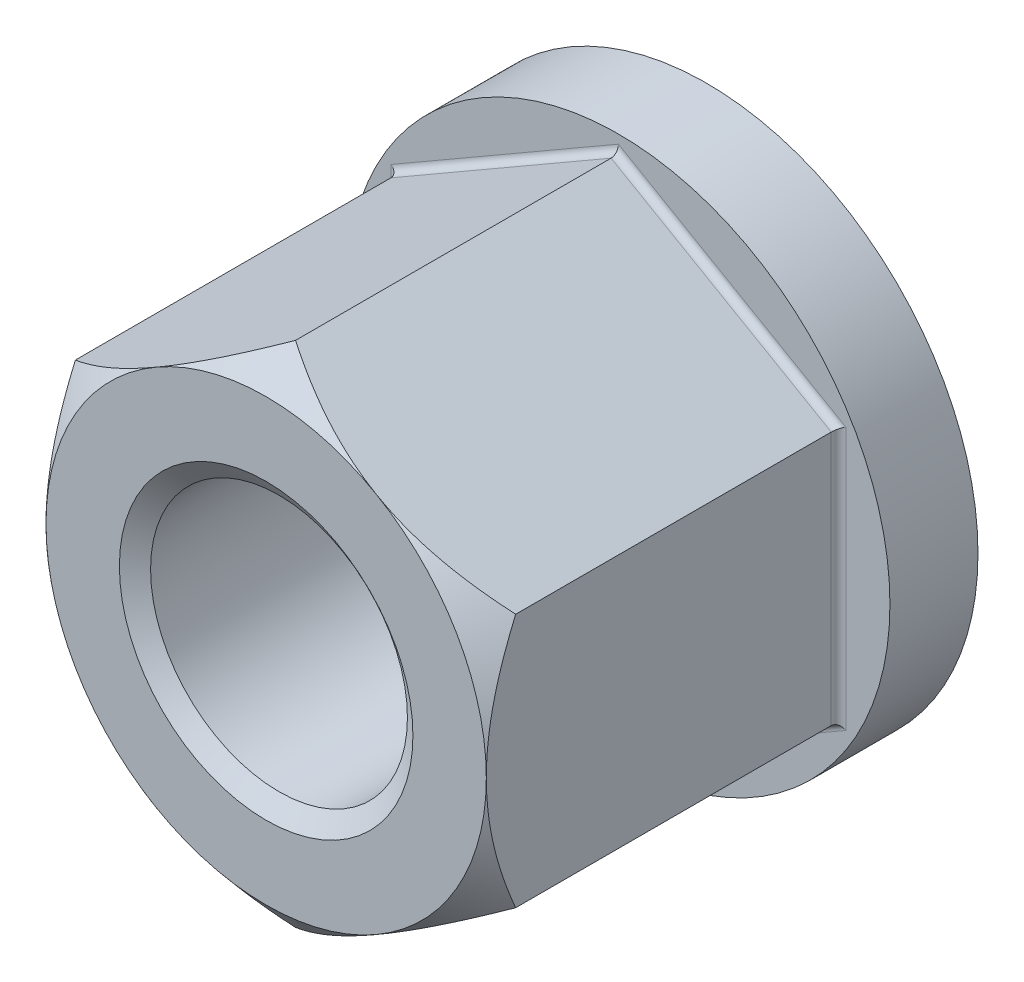
from build123d import *

# Parameters (mm, degrees)
BASENUTSKE_R  = 8.75
BASENUT_DEPTH = 30
COLLARSKE_W   = 6
COLLARSKE_H   = 9.75
FILLET_2_R    = 0.5


with BuildPart() as part:
    # BaseNutSke → BaseNut (new body)
    with BuildSketch(Plane.XY):
        Polygon((15, 8.660254038), (15, -8.660254038), (0, -17.320508076), (-15, -8.660254038), (-15, 8.660254038), (0, 17.320508076), align=None)
        Circle(BASENUTSKE_R, mode=Mode.SUBTRACT)
    extrude(amount=-BASENUT_DEPTH)

    # CollarSke → Collar (revolve)
    with BuildSketch(Plane(origin=(0, 0, 0), x_dir=(0, 0, -1), z_dir=(1, 0, 0)), mode=Mode.PRIVATE) as collar_sk:
        with Locations((27, 13.625)):
            Rectangle(COLLARSKE_W, COLLARSKE_H)
    revolve(collar_sk.sketch.rotate(Axis((0, 0, 0), (0, 0, -1)), 90), axis=Axis((0, 0, 0), (0, 0, -1)))

    # Sketch3 → Chamfer 2 (revolve, cut)
    with BuildSketch(Plane(origin=(0, 0, 0), x_dir=(0, 0, -1), z_dir=(1, 0, 0))):
        Polygon((2, 30.020508076), (-12.7, 30.020508076), (-12.7, 15), (0, 15), (2, 17.320508076), align=None)
    revolve(axis=Axis((0, 0, 0), (0, 0, -1)), mode=Mode.SUBTRACT)

    # Sketch5 → EndChamfer (revolve, cut)
    with BuildSketch(Plane(origin=(0, 0, 0), x_dir=(0, 0, -1), z_dir=(1, 0, 0)), mode=Mode.PRIVATE) as endchamfer_sk:
        Polygon((29.9746, 10), (29.011814635, 8.625), (30.0254, 8.625), (30.0254, 10), align=None)
        Polygon((-0.0508, 10), (0, 10), (0.962785365, 8.625), (-0.0508, 8.625), align=None)
    revolve(endchamfer_sk.sketch.rotate(Axis((0, 0, -25.037505729), (0, 0, -1)), 90), axis=Axis((0, 0, -25.037505729), (0, 0, -1)), mode=Mode.SUBTRACT)

    # Fillet 2
    fillet_2_edges = [part.edges().sort_by_distance(p)[0] for p in [
        (7.5, 12.990381057, -24),
        (-7.5, 12.990381057, -24),
        (-15, 0, -24),
        (-7.5, -12.990381057, -24),
        (7.5, -12.990381057, -24),
        (15, 0, -24),
    ]]
    fillet(fillet_2_edges, radius=FILLET_2_R)


solid = part.part
